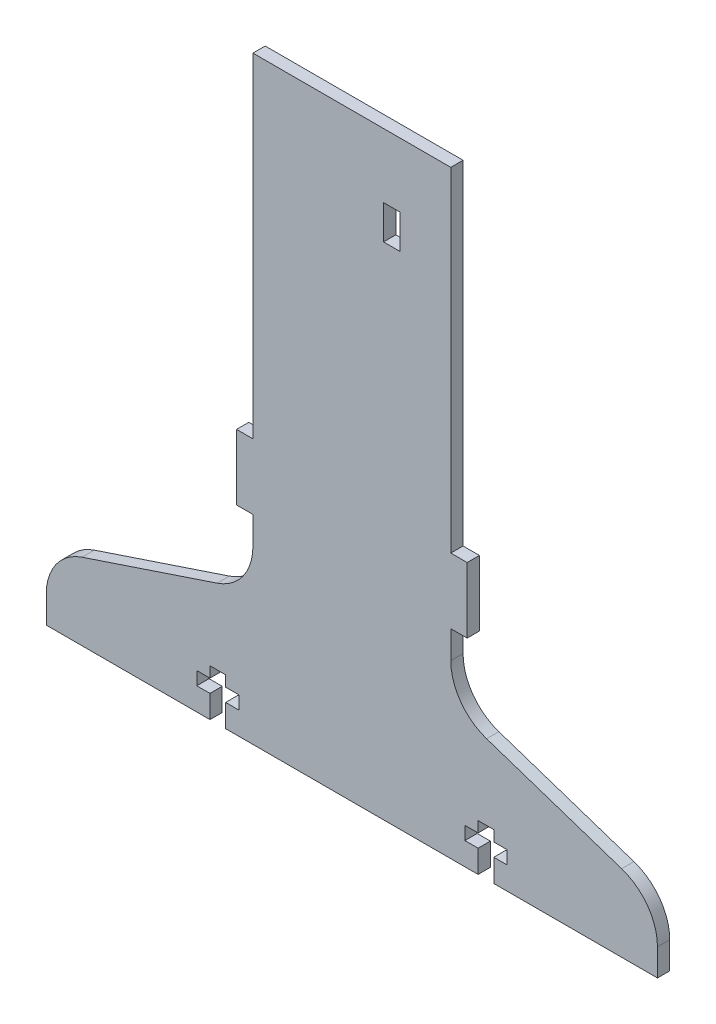
from build123d import *

# Parameters (mm, degrees)
SKETCH1_W           = 15.875
SKETCH1_H           = 83.83778
SKETCH1_W_2         = 3.175
SKETCH1_H_2         = 6.604
BOSS_EXTRUDE1_DEPTH = 2.38125
SKETCH2_W           = 5.42671
SKETCH2_H           = 83.83778
SKETCH2_W_2         = 23.424388
BOSS_EXTRUDE2_DEPTH = 2.38125
SKETCH3_W           = 3.175
SKETCH3_H           = 64.78778
SKETCH3_H_2         = 6.35
CUT_EXTRUDE2_DEPTH  = 90.543351098
BOSS_EXTRUDE4_DEPTH = 2.38125
FILLET1_R           = 10.16
CUT_EXTRUDE5_DEPTH  = 109.143259408


with BuildPart() as part:
    # Sketch1 → Boss-Extrude1 (new body)
    with BuildSketch(Plane.XY):
        with Locations((0, 41.91889)):
            Rectangle(SKETCH1_W, SKETCH1_H)
        with Locations((-1.27, 68.08976095)):
            Rectangle(SKETCH1_W_2, SKETCH1_H_2, mode=Mode.SUBTRACT)
    extrude(amount=BOSS_EXTRUDE1_DEPTH)

    # Sketch2 → Boss-Extrude2 (add)
    with BuildSketch(Plane.XY):
        with Locations((10.650855, 41.91889)):
            Rectangle(SKETCH2_W, SKETCH2_H)
        with Locations((-19.649694, 41.91889)):
            Rectangle(SKETCH2_W_2, SKETCH2_H)
    extrude(amount=BOSS_EXTRUDE2_DEPTH)

    # Sketch3 → Cut-Extrude2 (cut, through all)
    with BuildSketch(Plane.XY):
        with Locations((-29.774388, 51.44389)):
            Rectangle(SKETCH3_W, SKETCH3_H)
        with Locations((11.77671, 51.44389)):
            Rectangle(SKETCH3_W, SKETCH3_H)
        with Locations((-29.774388, 3.175)):
            Rectangle(SKETCH3_W, SKETCH3_H_2)
        with Locations((11.77671, 3.175)):
            Rectangle(SKETCH3_W, SKETCH3_H_2)
    extrude(amount=CUT_EXTRUDE2_DEPTH, mode=Mode.SUBTRACT)

    # Sketch5 → Boss-Extrude4 (add)
    with BuildSketch(Plane.XY):
        Polygon((-28.186888, 0), (-28.186888, -6.35), (-68.268007503, -19.717143922), (-68.268007503, -32.282068045), (50.270329503, -32.282068045), (50.270329503, -19.717143922), (10.18921, -6.35), (10.18921, 0), align=None)
    extrude(amount=BOSS_EXTRUDE4_DEPTH)

    # Fillet1
    fillet1_edges = [part.edges().sort_by_distance(p)[0] for p in [
        (-28.186888, -6.35, 1.190625),
        (-68.268007503, -19.717143922, 1.190625),
        (50.270329503, -19.717143922, 1.190625),
        (10.18921, -6.35, 1.190625),
    ]]
    fillet(fillet1_edges, radius=FILLET1_R)

    # Sketch6 → Cut-Extrude5 (cut, through all)
    with BuildSketch(Plane.XY):
        Polygon((-36.518007503, -32.282068045), (-36.518007503, -27.870697677), (-39.076507827, -27.870697677), (-39.076507827, -25.312197354), (-36.518007503, -25.312197354), (-36.518007503, -23.233415841), (-33.479788369, -23.233415841), (-33.479788369, -25.312197354), (-30.921288046, -25.312197354), (-30.921288046, -27.870697677), (-33.479788369, -27.870697677), (-33.479788369, -32.282068045), align=None)
        Polygon((15.482110369, -32.282068045), (15.482110369, -27.870697677), (12.923610046, -27.870697677), (12.923610046, -25.312197354), (15.482110369, -25.312197354), (15.482110369, -23.233415841), (18.520329503, -23.233415841), (18.520329503, -25.312197354), (21.078829827, -25.312197354), (21.078829827, -27.870697677), (18.520329503, -27.870697677), (18.520329503, -32.282068045), align=None)
    extrude(amount=CUT_EXTRUDE5_DEPTH, mode=Mode.SUBTRACT)


solid = part.part
